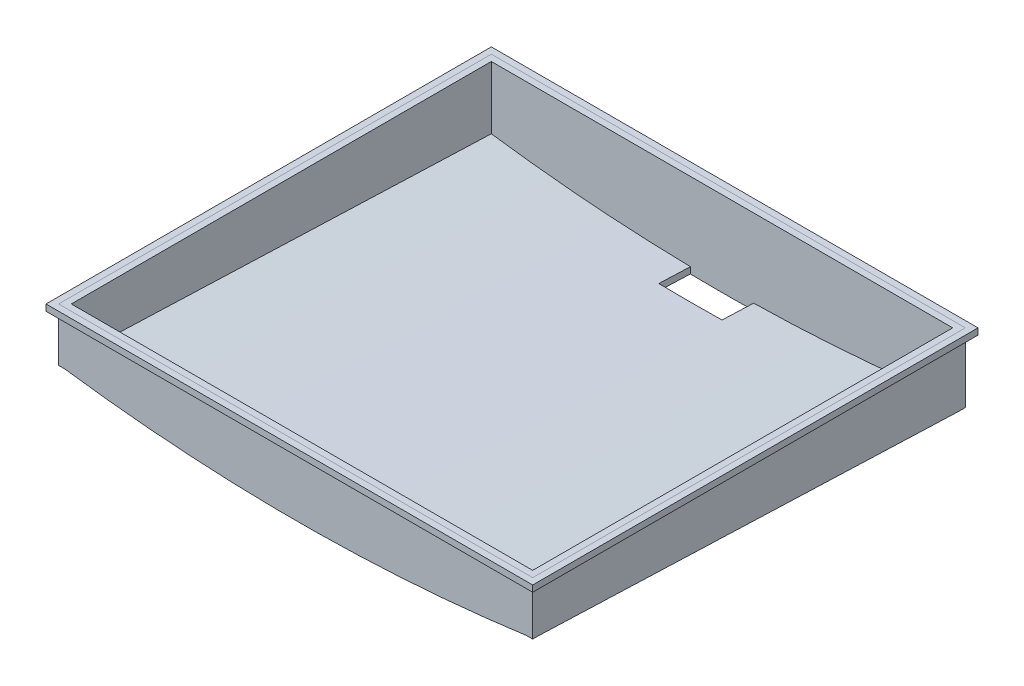
from build123d import *

# Parameters (mm, degrees)
BOSS_EXTRUDE1_DEPTH = 133
BOSS_EXTRUDE2_DEPTH = 2
LPATTERN1_COUNT     = 2
LPATTERN1_PITCH     = 148
BOSS_EXTRUDE3_DEPTH = 2
BOSS_EXTRUDE4_DEPTH = 2
SKETCH10_W          = 154
SKETCH10_H          = 140.906114543
SKETCH10_W_2        = 150
SKETCH10_H_2        = 136.906114543
BOSS_EXTRUDE5_DEPTH = 2
SKETCH11_W          = 20
SKETCH11_H          = 10
CUT_EXTRUDE1_DEPTH  = 160.348074773


with BuildPart() as part:
    # Sketch1 → Boss-Extrude1 (new, along a direction that is not the sketch's normal)
    with BuildSketch(Plane.XY):
        with BuildLine():
            Line((73, 0), (73, -2.018782539))
            ThreePointArc((73, -2.018782539), (0, -7), (-73, -2.018782539))
            Line((-73, -2.018782539), (-73, 0))
            ThreePointArc((-73, 0), (0, -5), (73, 0))
        make_face()
    extrude(amount=-BOSS_EXTRUDE1_DEPTH, dir=(0, 0.03756744715435067, 0.9992940943057279))

    # Sketch3 → Boss-Extrude2 (add)
    with BuildSketch(Plane.ZY.offset(73)):
        Polygon((-132.906114543, -4.996470472), (-132.906114543, 14.827487749), (0, 14.827487749), (0, -2.018782539), (-132.906114543, -7.01525301), align=None)
    boss_extrude2 = extrude(amount=BOSS_EXTRUDE2_DEPTH)

    # LPattern1: Boss-Extrude2 ×2
    with Locations(*[(i * LPATTERN1_PITCH, 0, 0) for i in range(1, LPATTERN1_COUNT)]):
        add(boss_extrude2)

    # Sketch6 → Boss-Extrude3 (add)
    with BuildSketch(Plane.XY):
        with BuildLine():
            Line((-73, 14.827487749), (73, 14.827487749))
            Line((73, 14.827487749), (75, 14.827487749))
            Line((75, 14.827487749), (75, -2.018782539))
            Line((75, -2.018782539), (73, -2.018782539))
            ThreePointArc((73, -2.018782539), (0, -7), (-73, -2.018782539))
            Line((-73, -2.018782539), (-75, -2.018782539))
            Line((-75, -2.018782539), (-75, 14.827487749))
            Line((-75, 14.827487749), (-73, 14.827487749))
        make_face()
    extrude(amount=BOSS_EXTRUDE3_DEPTH)

    # Sketch7 → Boss-Extrude4 (add)
    with BuildSketch(Plane(origin=(0, 0, -132.906114543), x_dir=(-1, 0, 0), z_dir=(0, 0, -1))):
        with BuildLine():
            Line((-73, 14.827487749), (73, 14.827487749))
            Line((73, 14.827487749), (75, 14.827487749))
            Line((75, 14.827487749), (75, -7.01525301))
            Line((75, -7.01525301), (73, -7.01525301))
            ThreePointArc((73, -7.01525301), (0, -11.996470472), (-73, -7.01525301))
            Line((-73, -7.01525301), (-75, -7.01525301))
            Line((-75, -7.01525301), (-75, 14.827487749))
            Line((-75, 14.827487749), (-73, 14.827487749))
        make_face()
    extrude(amount=BOSS_EXTRUDE4_DEPTH)

    # Sketch11 → Cut-Extrude1 (cut, through all)
    with BuildSketch(Plane(origin=(0, 14.827487749, 0), x_dir=(1, 0, 0), z_dir=(0, 1, 0))):
        with Locations((0, 127.906114543)):
            Rectangle(SKETCH11_W, SKETCH11_H)
    extrude(amount=-CUT_EXTRUDE1_DEPTH, mode=Mode.SUBTRACT)


with BuildPart() as body_2:
    # Sketch10 → Boss-Extrude5 (new body)
    with BuildSketch(Plane(origin=(0, 14.827487749, 0), x_dir=(1, 0, 0), z_dir=(0, 1, 0))):
        with Locations((0, 66.453057272)):
            Rectangle(SKETCH10_W, SKETCH10_H)
        with Locations((0, 66.453057272)):
            Rectangle(SKETCH10_W_2, SKETCH10_H_2, mode=Mode.SUBTRACT)
    extrude(amount=-BOSS_EXTRUDE5_DEPTH)


solid = Compound([part.part, body_2.part])
